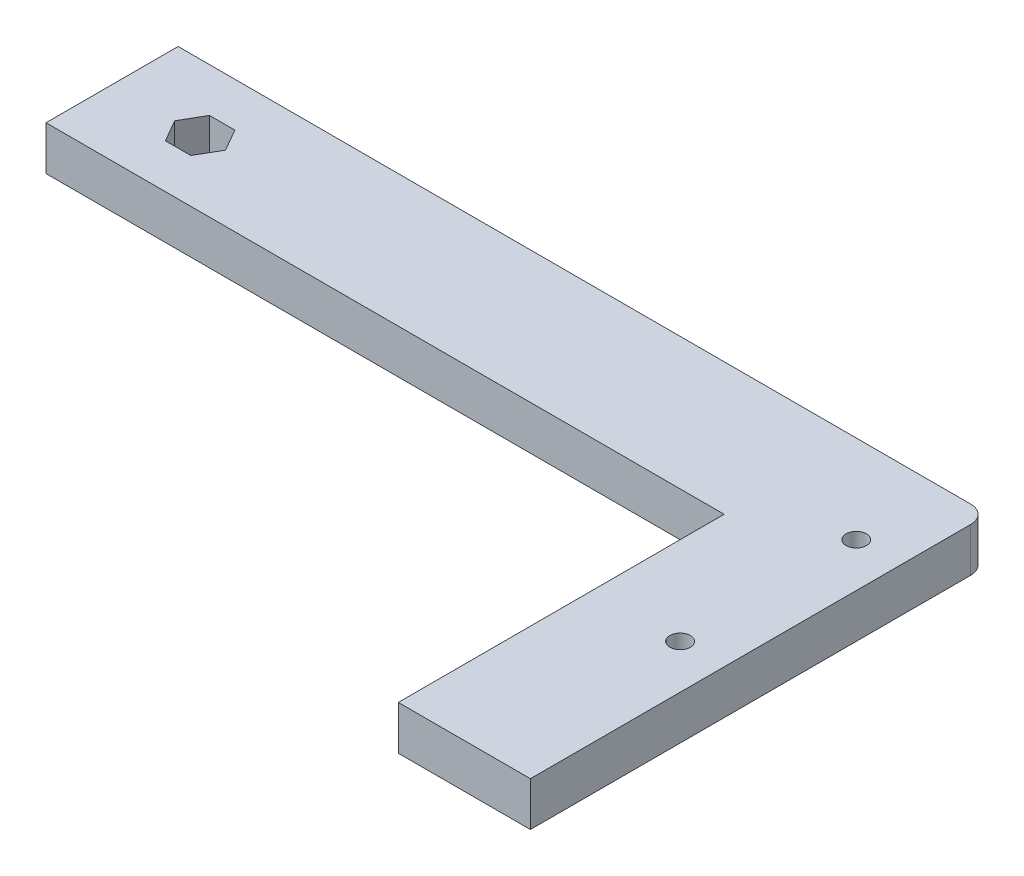
from build123d import *

# Parameters (mm, degrees)
BOSS_EXTRUDE1_DEPTH = 6.35
CUT_EXTRUDE1_DEPTH  = 135.362158735
SKETCH3_R           = 1.4732
CUT_EXTRUDE2_DEPTH  = 135.362158735


with BuildPart() as part:
    # Sketch1 → Boss-Extrude1 (new body)
    with BuildSketch(Plane(origin=(0, 0, 0), x_dir=(1, 0, 0), z_dir=(0, 1, 0))):
        with BuildLine():
            Line((0, 0), (114.3, 0))
            ThreePointArc((114.3, 0), (116.096051224, -0.743948776), (116.84, -2.54))
            Line((116.84, -2.54), (116.84, -66.04))
            Line((116.84, -66.04), (97.79, -66.04))
            Line((97.79, -66.04), (97.79, -19.05))
            Line((97.79, -19.05), (0, -19.05))
            Line((0, -19.05), (0, 0))
        make_face()
    extrude(amount=BOSS_EXTRUDE1_DEPTH)

    # Sketch2 → Cut-Extrude1 (cut, through all)
    with BuildSketch(Plane(origin=(0, 6.35, 0), x_dir=(1, 0, 0), z_dir=(0, 1, 0))):
        Polygon((14.533087105, -12.7), (16.366174209, -9.525), (14.533087105, -6.35), (10.866912895, -6.35), (9.033825791, -9.525), (10.866912895, -12.7), align=None)
    extrude(amount=-CUT_EXTRUDE1_DEPTH, mode=Mode.SUBTRACT)

    # Sketch3 → Cut-Extrude2 (cut, through all)
    with BuildSketch(Plane.XZ):
        with Locations(Location((110.49, 38.1, 0), (0, 0, 270))):
            Circle(SKETCH3_R)
        with Locations(Location((110.49, 12.7, 0), (0, 0, 270))):
            Circle(SKETCH3_R)
    extrude(amount=-CUT_EXTRUDE2_DEPTH, mode=Mode.SUBTRACT)


solid = part.part
